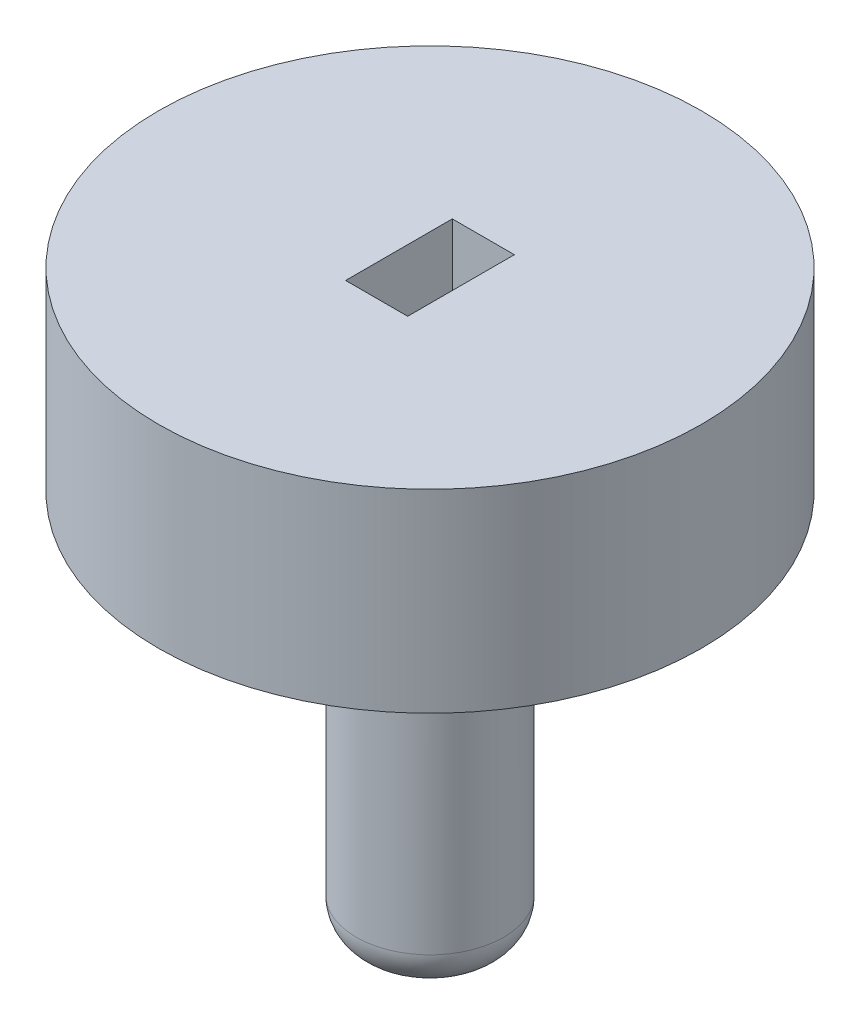
from build123d import *

# Parameters (mm, degrees)
SKETCH_1_R          = 14
EXTRUDE_1_DEPTH     = 5
SKETCH_2_R          = 14
EXTRUDE_2_DEPTH     = 5
SKETCH_4_R          = 3.8
EXTRUDE_3_DEPTH     = 25
FILLET_1_R          = 2
SKETCH_3_W          = 3.2
SKETCH_3_H          = 5.5
CUT_EXTRUDE_1_DEPTH = 5.5


with BuildPart() as part:
    # Эскиз1 → Бобышка-Вытянуть1 (new body)
    with BuildSketch(Plane(origin=(0, 0, 0), x_dir=(1, 0, 0), z_dir=(0, 1, 0))):
        with Locations(Location((0, 0, 0), (0, 0, 270))):
            Circle(SKETCH_1_R)
        with BuildLine():
            ThreePointArc((-7.383246629, 9.45979224), (-7.957471899, 8.982128978), (-8.500867665, 8.469666401))
            ThreePointArc((-8.500867665, 8.469666401), (-8.106391079, 5.595437755), (-10.933724873, 4.945064246))
            ThreePointArc((-10.933724873, 4.945064246), (-11.220194912, 4.255258645), (-11.463194733, 3.548966963))
            ThreePointArc((-11.463194733, 3.548966963), (-9.77818241, 1.187286301), (-11.979418514, -0.702518371))
            ThreePointArc((-11.979418514, -0.702518371), (-11.912506489, -1.446440163), (-11.799442035, -2.184758036))
            ThreePointArc((-11.799442035, -2.184758036), (-9.20990999, -3.492858137), (-10.280771741, -6.189162496))
            ThreePointArc((-10.280771741, -6.189162496), (-9.875806391, -6.816776961), (-9.432579364, -7.417981298))
            ThreePointArc((-9.432579364, -7.417981298), (-6.531758184, -7.372830869), (-6.226924059, -10.25794408))
            ThreePointArc((-6.226924059, -10.25794408), (-5.576678065, -10.625472308), (-4.904826437, -10.951834441))
            ThreePointArc((-4.904826437, -10.951834441), (-2.357259293, -9.563776902), (-0.746563118, -11.976754298))
            ThreePointArc((-0.746563118, -11.976754298), (0, -12), (0.746563118, -11.976754298))
            ThreePointArc((0.746563118, -11.976754298), (2.357259293, -9.563776902), (4.904826437, -10.951834441))
            ThreePointArc((4.904826437, -10.951834441), (5.576678065, -10.625472308), (6.226924059, -10.25794408))
            ThreePointArc((6.226924059, -10.25794408), (6.531758184, -7.372830869), (9.432579364, -7.417981298))
            ThreePointArc((9.432579364, -7.417981298), (9.875806391, -6.816776961), (10.280771741, -6.189162496))
            ThreePointArc((10.280771741, -6.189162496), (9.20990999, -3.492858137), (11.799442035, -2.184758036))
            ThreePointArc((11.799442035, -2.184758036), (11.912506489, -1.446440163), (11.979418514, -0.702518371))
            ThreePointArc((11.979418514, -0.702518371), (9.77818241, 1.187286301), (11.463194733, 3.548966963))
            ThreePointArc((11.463194733, 3.548966963), (11.220194912, 4.255258645), (10.933724873, 4.945064246))
            ThreePointArc((10.933724873, 4.945064246), (8.106391079, 5.595437755), (8.500867665, 8.469666401))
            ThreePointArc((8.500867665, 8.469666401), (7.957471899, 8.982128978), (7.383246629, 9.45979224))
            ThreePointArc((7.383246629, 9.45979224), (4.577523245, 8.721741853), (3.591094261, 11.450067336))
            ThreePointArc((3.591094261, 11.450067336), (2.871787971, 11.651301809), (2.14135556, 11.807395833))
            ThreePointArc((2.14135556, 11.807395833), (0, 9.85), (-2.14135556, 11.807395833))
            ThreePointArc((-2.14135556, 11.807395833), (-2.871787971, 11.651301809), (-3.591094261, 11.450067336))
            ThreePointArc((-3.591094261, 11.450067336), (-4.577523245, 8.721741853), (-7.383246629, 9.45979224))
        make_face(mode=Mode.SUBTRACT)
    extrude(amount=EXTRUDE_1_DEPTH)

    # Эскиз2 → Бобышка-Вытянуть2 (add)
    with BuildSketch(Plane(origin=(0, 5, 0), x_dir=(1, 0, 0), z_dir=(0, 1, 0))):
        with Locations(Location((0, 0, 0), (0, 0, 270))):
            Circle(SKETCH_2_R)
    extrude(amount=EXTRUDE_2_DEPTH)

    # Эскиз4 → Бобышка-Вытянуть3 (add)
    with BuildSketch(Plane.XZ.offset(-5)):
        with Locations(Location((0, 0, 0), (0, 0, 90))):
            Circle(SKETCH_4_R)
    extrude(amount=EXTRUDE_3_DEPTH)

    # Скругление1
    fillet_1_edges = [part.edges().sort_by_distance(p)[0] for p in [
        (0, -20, -3.8),
    ]]
    fillet(fillet_1_edges, radius=FILLET_1_R)

    # Эскиз3 → Вырез-Вытянуть1 (cut)
    with BuildSketch(Plane(origin=(0, 10, 0), x_dir=(1, 0, 0), z_dir=(0, 1, 0))):
        Rectangle(SKETCH_3_W, SKETCH_3_H)
    extrude(amount=-CUT_EXTRUDE_1_DEPTH, mode=Mode.SUBTRACT)


solid = part.part
